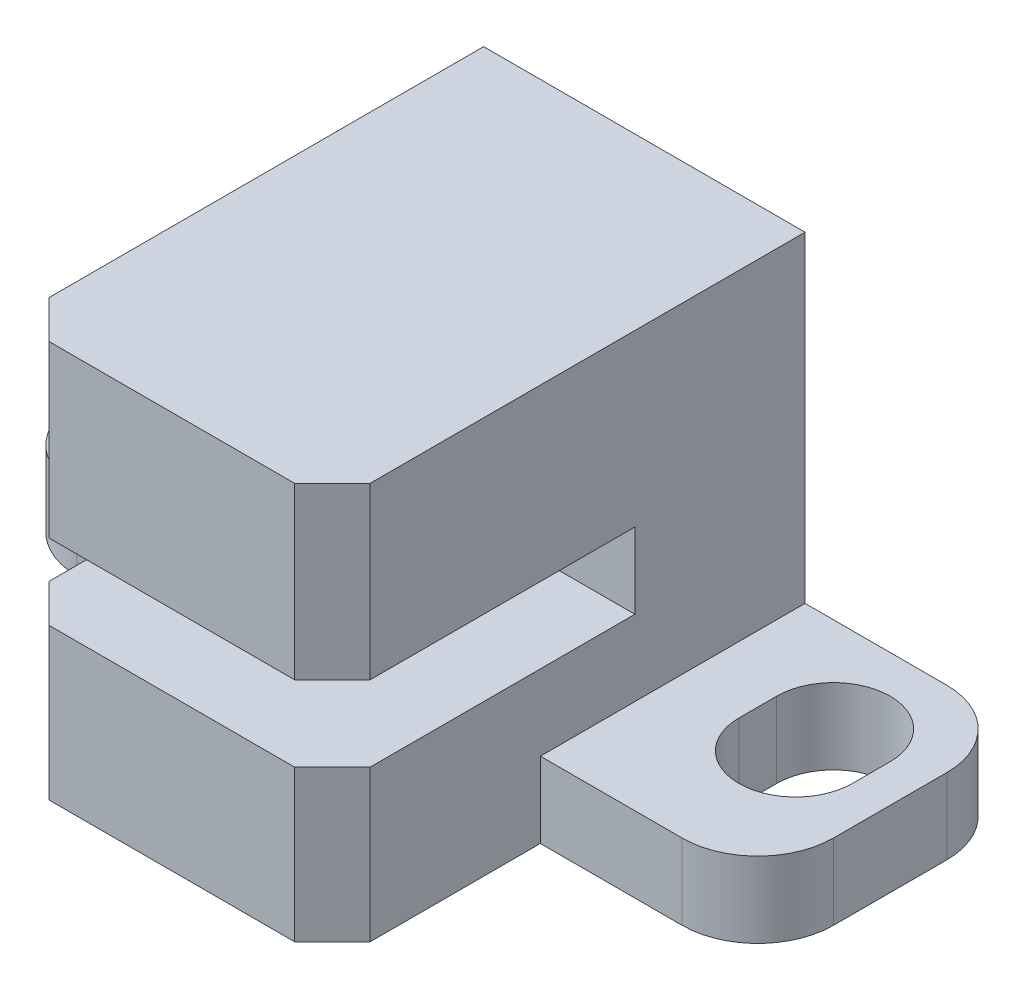
from build123d import *

# Parameters (mm, degrees)
SKETCH1_W           = 8.5
SKETCH1_H           = 10.5
BOSS_EXTRUDE1_DEPTH = 12.5
SKETCH2_W           = 8.5
SKETCH2_H           = 2
CUT_EXTRUDE1_DEPTH  = 8
BOSS_EXTRUDE2_DEPTH = 2
CHAMFER1_SIZE       = 1


with BuildPart() as part:
    # Sketch1 → Boss-Extrude1 (new body)
    with BuildSketch(Plane.XY):
        Rectangle(SKETCH1_W, SKETCH1_H)
    extrude(amount=BOSS_EXTRUDE1_DEPTH)

    # Sketch2 → Cut-Extrude1 (cut)
    with BuildSketch(Plane.XY.offset(12.5)):
        with Locations((0, -0.25)):
            Rectangle(SKETCH2_W, SKETCH2_H)
    extrude(amount=-CUT_EXTRUDE1_DEPTH, mode=Mode.SUBTRACT)

    # Sketch3 → Boss-Extrude2 (add)
    # profile 1 of 2: a face of its own
    with BuildSketch(Plane.XZ.offset(5.25)):
        with BuildLine():
            Line((4.25, 0), (8, 0))
            ThreePointArc((8, 0), (9.414213562, 0.585786438), (10, 2))
            Line((10, 2), (10, 5))
            ThreePointArc((10, 5), (9.414213562, 6.414213562), (8, 7))
            Line((8, 7), (4.25, 7))
            Line((4.25, 7), (4.25, 0))
        make_face()
        with BuildLine():
            Line((6, 2.5), (6, 3.5))
            ThreePointArc((6, 3.5), (7.5, 5), (9, 3.5))
            Line((9, 3.5), (9, 2.5))
            ThreePointArc((9, 2.5), (7.5, 1), (6, 2.5))
        make_face(mode=Mode.SUBTRACT)
    # profile 2 of 2: a face of its own
    with BuildSketch(Plane.XZ.offset(5.25)):
        with BuildLine():
            Line((-10, 2), (-10, 5))
            ThreePointArc((-10, 5), (-9.414213562, 6.414213562), (-8, 7))
            Line((-8, 7), (-4.25, 7))
            Line((-4.25, 7), (-4.25, 0))
            Line((-4.25, 0), (-8, 0))
            ThreePointArc((-8, 0), (-9.414213562, 0.585786438), (-10, 2))
        make_face()
        with BuildLine():
            Line((-6, 2.5), (-6, 3.5))
            ThreePointArc((-6, 3.5), (-7.5, 5), (-9, 3.5))
            Line((-9, 3.5), (-9, 2.5))
            ThreePointArc((-9, 2.5), (-7.5, 1), (-6, 2.5))
        make_face(mode=Mode.SUBTRACT)
    extrude(amount=-BOSS_EXTRUDE2_DEPTH)

    # Chamfer1
    chamfer1_edges = [part.edges().sort_by_distance(p)[0] for p in [
        (-4.25, 3, 12.5),
        (4.25, 3, 12.5),
        (-4.25, -3.25, 12.5),
        (4.25, -3.25, 12.5),
    ]]
    chamfer(chamfer1_edges, length=CHAMFER1_SIZE)


solid = part.part
